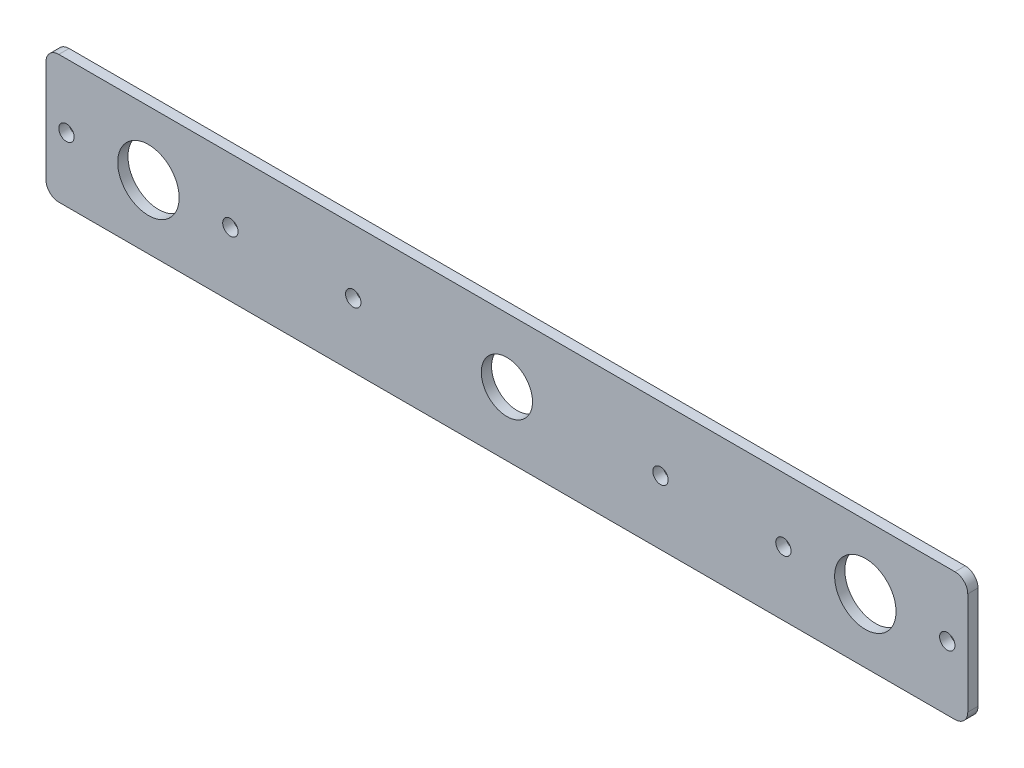
from build123d import *

# Parameters (mm, degrees)
MODEL_R             = 1.5
MODEL_R_2           = 5
MODEL_R_3           = 6
BOSS_EXTRUDE1_DEPTH = 2


with BuildPart() as part:
    # Model → Boss-Extrude1 (new body)
    with BuildSketch(Plane.XY):
        with BuildLine():
            Line((-87.5, 25), (87.5, 25))
            ThreePointArc((87.5, 25), (89.267766953, 24.267766953), (90, 22.5))
            Line((90, 22.5), (90, 2.5))
            ThreePointArc((90, 2.5), (89.267766953, 0.732233047), (87.5, 0))
            Line((87.5, 0), (-87.5, 0))
            ThreePointArc((-87.5, 0), (-89.267766953, 0.732233047), (-90, 2.5))
            Line((-90, 2.5), (-90, 22.5))
            ThreePointArc((-90, 22.5), (-89.267766953, 24.267766953), (-87.5, 25))
        make_face()
        with Locations((86, 12.5)):
            Circle(MODEL_R, mode=Mode.SUBTRACT)
        with Locations(Location((-86, 12.5, 0), (0, 0, 180))):
            Circle(MODEL_R, mode=Mode.SUBTRACT)
        with Locations((0, 12.5)):
            Circle(MODEL_R_2, mode=Mode.SUBTRACT)
        with Locations((-70, 12.5)):
            Circle(MODEL_R_3, mode=Mode.SUBTRACT)
        with Locations(Location((70, 12.5, 0), (0, 0, 180))):
            Circle(MODEL_R_3, mode=Mode.SUBTRACT)
        with Locations((-54, 12.5)):
            Circle(MODEL_R, mode=Mode.SUBTRACT)
        with Locations(Location((54, 12.5, 0), (0, 0, 180))):
            Circle(MODEL_R, mode=Mode.SUBTRACT)
        with Locations((-30, 12.5)):
            Circle(MODEL_R, mode=Mode.SUBTRACT)
        with Locations(Location((30, 12.5, 0), (0, 0, 180))):
            Circle(MODEL_R, mode=Mode.SUBTRACT)
    extrude(amount=BOSS_EXTRUDE1_DEPTH)


solid = part.part
